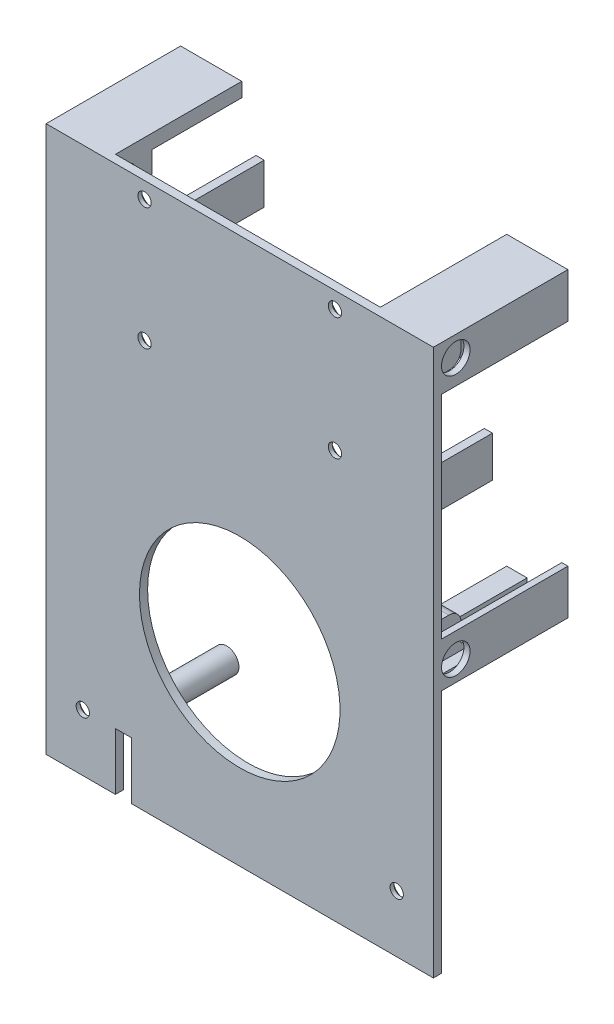
from build123d import *

# Parameters (mm, degrees)
SKETCH1_W                                 = 95
SKETCH1_H                                 = 134
BOSS_EXTRUDE1_DEPTH                       = 2
CSK_FOR_4_FLAT_HEAD_MACHINE_SCREW_2_COUNT = 2
CSK_FOR_4_FLAT_HEAD_MACHINE_SCREW_2_PITCH = 46.7
CSK_FOR_4_FLAT_HEAD_MACHINE_SCREW_3_COUNT = 2
CSK_FOR_4_FLAT_HEAD_MACHINE_SCREW_3_PITCH = 55.505765466
CSK_FOR_4_FLAT_HEAD_MACHINE_SCREW_4_COUNT = 2
CSK_FOR_4_FLAT_HEAD_MACHINE_SCREW_4_PITCH = 30
CSK_FOR_4_FLAT_HEAD_MACHINE_SCREW_5_COUNT = 2
CSK_FOR_4_FLAT_HEAD_MACHINE_SCREW_5_PITCH = 116.985137945
CSK_FOR_4_FLAT_HEAD_MACHINE_SCREW_6_COUNT = 2
CSK_FOR_4_FLAT_HEAD_MACHINE_SCREW_6_PITCH = 131.458824352
SKETCH13_R                                = 24.6
CUT_EXTRUDE2_DEPTH                        = 165.271117364
SKETCH14_R                                = 3
BOSS_EXTRUDE4_DEPTH                       = 19.3
SKETCH15_R                                = 1.15
CUT_EXTRUDE3_DEPTH                        = 15
SKETCH16_W                                = 4
SKETCH16_H                                = 14
CUT_EXTRUDE4_DEPTH                        = 166.388905311
SKETCH17_W                                = 15
SKETCH17_H                                = 11
BOSS_EXTRUDE5_DEPTH                       = 31
SKETCH18_W                                = 2.7
SKETCH18_H                                = 70
CUT_EXTRUDE5_DEPTH                        = 31
SKETCH19_W                                = 14.3
SKETCH19_H                                = 67
CUT_EXTRUDE6_DEPTH                        = 22
FILLET5_R                                 = 3
FILLET6_R                                 = 3
FILLET7_R                                 = 3
FILLET8_R                                 = 3
SKETCH20_W                                = 2
SKETCH20_H                                = 10
BOSS_EXTRUDE6_DEPTH                       = 31
CUT_EXTRUDE7_DEPTH                        = 165.807888161
CUT_EXTRUDE7_DEPTH_BACK                   = 165.807888161
SKETCH22_R                                = 1.15
SKETCH23_R                                = 3.5
CUT_EXTRUDE8_DEPTH                        = 1.5
CUT_EXTRUDE9_START                        = -1.5
SKETCH24_R                                = 3.5
CUT_EXTRUDE9_DEPTH                        = 1.5
SKETCH25_W                                = 3
SKETCH25_H                                = 3.5
CUT_EXTRUDE10_DEPTH                       = 17


with BuildPart() as part:
    # Sketch1 → Boss-Extrude1 (new body)
    with BuildSketch(Plane.XY):
        with Locations((47.5, 67)):
            Rectangle(SKETCH1_W, SKETCH1_H)
    extrude(amount=BOSS_EXTRUDE1_DEPTH)

    # Sketch8 → CSK for #4 Flat Head Machine Screw (100)2 (revolve, cut)
    with BuildSketch(Plane(origin=(70.85, 130, 0), x_dir=(0, 1, 0), z_dir=(1, 0, 0))):
        Polygon((0, 0), (0, 2), (1.63195, 2), (1.63195, 1.028358553), (2.8575, 0), align=None)
    csk_for_4_flat_head_machine_screw_100 = revolve(axis=Axis((70.85, 130, -6.35), (0, 0, 1)), mode=Mode.SUBTRACT)

    # CSK for _4 Flat Head Machine Screw _ 2: CSK for #4 Flat Head Machine Screw (100)2 ×2
    with Locations(*[(-i * CSK_FOR_4_FLAT_HEAD_MACHINE_SCREW_2_PITCH, 0, 0) for i in range(1, CSK_FOR_4_FLAT_HEAD_MACHINE_SCREW_2_COUNT)]):
        add(csk_for_4_flat_head_machine_screw_100, mode=Mode.SUBTRACT)

    # CSK for _4 Flat Head Machine Screw _ 3: CSK for #4 Flat Head Machine Screw (100)2 ×2
    with Locations(*[Vector(-0.8413540396691381, -0.540484393791738, 0) * (i * CSK_FOR_4_FLAT_HEAD_MACHINE_SCREW_3_PITCH) for i in range(1, CSK_FOR_4_FLAT_HEAD_MACHINE_SCREW_3_COUNT)]):
        add(csk_for_4_flat_head_machine_screw_100, mode=Mode.SUBTRACT)

    # CSK for _4 Flat Head Machine Screw _ 4: CSK for #4 Flat Head Machine Screw (100)2 ×2
    with Locations(*[(0, -i * CSK_FOR_4_FLAT_HEAD_MACHINE_SCREW_4_PITCH, 0) for i in range(1, CSK_FOR_4_FLAT_HEAD_MACHINE_SCREW_4_COUNT)]):
        add(csk_for_4_flat_head_machine_screw_100, mode=Mode.SUBTRACT)

    # CSK for _4 Flat Head Machine Screw _ 5: CSK for #4 Flat Head Machine Screw (100)2 ×2
    with Locations(*[Vector(0.12950362982970207, -0.991578947870986, 0) * (i * CSK_FOR_4_FLAT_HEAD_MACHINE_SCREW_5_PITCH) for i in range(1, CSK_FOR_4_FLAT_HEAD_MACHINE_SCREW_5_COUNT)]):
        add(csk_for_4_flat_head_machine_screw_100, mode=Mode.SUBTRACT)

    # CSK for _4 Flat Head Machine Screw _ 6: CSK for #4 Flat Head Machine Screw (100)2 ×2
    with Locations(*[Vector(-0.47048952632046626, -0.8824055788710445, 0) * (i * CSK_FOR_4_FLAT_HEAD_MACHINE_SCREW_6_PITCH) for i in range(1, CSK_FOR_4_FLAT_HEAD_MACHINE_SCREW_6_COUNT)]):
        add(csk_for_4_flat_head_machine_screw_100, mode=Mode.SUBTRACT)

    # Sketch13 → Cut-Extrude2 (cut, through all)
    with BuildSketch(Plane(origin=(0, 0, 0), x_dir=(-1, 0, 0), z_dir=(0, 0, -1))):
        with Locations((-47.5, 45.5)):
            Circle(SKETCH13_R)
    extrude(amount=-CUT_EXTRUDE2_DEPTH, mode=Mode.SUBTRACT)

    # Sketch14 → Boss-Extrude4 (add)
    with BuildSketch(Plane(origin=(0, 0, 0), x_dir=(-1, 0, 0), z_dir=(0, 0, -1))):
        with Locations((-72, 70.1)):
            Circle(SKETCH14_R)
        with Locations((-23, 70.1)):
            Circle(SKETCH14_R)
        with Locations((-72, 20.9)):
            Circle(SKETCH14_R)
        with Locations((-23, 20.9)):
            Circle(SKETCH14_R)
    extrude(amount=BOSS_EXTRUDE4_DEPTH)

    # Sketch15 → Cut-Extrude3 (cut)
    with BuildSketch(Plane(origin=(0, 0, -19.3), x_dir=(-1, 0, 0), z_dir=(0, 0, -1))):
        with Locations((-72, 70.1)):
            Circle(SKETCH15_R)
        with Locations((-23, 70.1)):
            Circle(SKETCH15_R)
        with Locations((-23, 20.9)):
            Circle(SKETCH15_R)
        with Locations((-72, 20.9)):
            Circle(SKETCH15_R)
    extrude(amount=-CUT_EXTRUDE3_DEPTH, mode=Mode.SUBTRACT)

    # Sketch16 → Cut-Extrude4 (cut, through all)
    with BuildSketch(Plane(origin=(0, 0, 0), x_dir=(-1, 0, 0), z_dir=(0, 0, -1))):
        with Locations((-19, 7)):
            Rectangle(SKETCH16_W, SKETCH16_H)
    extrude(amount=-CUT_EXTRUDE4_DEPTH, mode=Mode.SUBTRACT)

    # Sketch17 → Boss-Extrude5 (add)
    with BuildSketch(Plane(origin=(0, 0, 0), x_dir=(-1, 0, 0), z_dir=(0, 0, -1))):
        with Locations((-87.5, 128.5)):
            Rectangle(SKETCH17_W, SKETCH17_H)
        with Locations((-87.5, 65.5)):
            Rectangle(SKETCH17_W, SKETCH17_H)
        with Locations((-7.5, 65.5)):
            Rectangle(SKETCH17_W, SKETCH17_H)
        with Locations((-7.5, 128.5)):
            Rectangle(SKETCH17_W, SKETCH17_H)
    extrude(amount=BOSS_EXTRUDE5_DEPTH)

    # Sketch18 → Cut-Extrude5 (cut)
    with BuildSketch(Plane(origin=(0, 0, -31), x_dir=(-1, 0, 0), z_dir=(0, 0, -1))):
        with Locations((-92.15, 97)):
            Rectangle(SKETCH18_W, SKETCH18_H)
        with Locations((-2.85, 97)):
            Rectangle(SKETCH18_W, SKETCH18_H)
    extrude(amount=-CUT_EXTRUDE5_DEPTH, mode=Mode.SUBTRACT)

    # Sketch19 → Cut-Extrude6 (cut)
    with BuildSketch(Plane(origin=(0, 0, -31), x_dir=(-1, 0, 0), z_dir=(0, 0, -1))):
        with Locations((-83.65, 97)):
            Rectangle(SKETCH19_W, SKETCH19_H)
        with Locations((-11.35, 97)):
            Rectangle(SKETCH19_W, SKETCH19_H)
    extrude(amount=-CUT_EXTRUDE6_DEPTH, mode=Mode.SUBTRACT)

    # Fillet5
    fillet5_edges = [part.edges().sort_by_distance(p)[0] for p in [
        (85.4, 123, -9),
    ]]
    fillet(fillet5_edges, radius=FILLET5_R)

    # Fillet6
    fillet6_edges = [part.edges().sort_by_distance(p)[0] for p in [
        (9.6, 123, -9),
    ]]
    fillet(fillet6_edges, radius=FILLET6_R)

    # Fillet7
    fillet7_edges = [part.edges().sort_by_distance(p)[0] for p in [
        (9.6, 71, -9),
    ]]
    fillet(fillet7_edges, radius=FILLET7_R)

    # Fillet8
    fillet8_edges = [part.edges().sort_by_distance(p)[0] for p in [
        (85.4, 71, -9),
    ]]
    fillet(fillet8_edges, radius=FILLET8_R)

    # Sketch20 → Boss-Extrude6 (add)
    with BuildSketch(Plane(origin=(0, 0, 0), x_dir=(-1, 0, 0), z_dir=(0, 0, -1))):
        with Locations((-75.5, 115)):
            Rectangle(SKETCH20_W, SKETCH20_H)
        with Locations((-75.5, 85)):
            Rectangle(SKETCH20_W, SKETCH20_H)
        with Locations((-19.5, 85)):
            Rectangle(SKETCH20_W, SKETCH20_H)
        with Locations((-19.5, 115)):
            Rectangle(SKETCH20_W, SKETCH20_H)
    extrude(amount=BOSS_EXTRUDE6_DEPTH)

    # Sketch22 → Cut-Extrude7 (cut, two sides: drawn at the far end of the back side and taken through both)
    with BuildSketch(Plane(origin=(90.8, 0, 0), x_dir=(0, 0, -1), z_dir=(1, 0, 0)).offset(-CUT_EXTRUDE7_DEPTH_BACK)):
        with Locations((3.5, 129)):
            Circle(SKETCH22_R)
        with Locations(Location((3.5, 65, 0), (0, 0, 90))):
            Circle(SKETCH22_R)
    extrude(amount=CUT_EXTRUDE7_DEPTH + CUT_EXTRUDE7_DEPTH_BACK, mode=Mode.SUBTRACT)

    # Sketch23 → Cut-Extrude8 (cut)
    with BuildSketch(Plane(origin=(95, 0, 0), x_dir=(0, 0, -1), z_dir=(1, 0, 0))):
        with Locations((3.5, 129)):
            Circle(SKETCH23_R)
        with Locations((3.5, 65)):
            Circle(SKETCH23_R)
    extrude(amount=-CUT_EXTRUDE8_DEPTH, mode=Mode.SUBTRACT)

    # Sketch24 → Cut-Extrude9 (cut)
    with BuildSketch(Plane.ZY.offset(CUT_EXTRUDE9_START)):
        with Locations(Location((-3.5, 129, 0), (0, 0, 180))):
            Circle(SKETCH24_R)
        with Locations(Location((-3.5, 65, 0), (0, 0, 180))):
            Circle(SKETCH24_R)
    extrude(amount=CUT_EXTRUDE9_DEPTH, mode=Mode.SUBTRACT)

    # Sketch25 → Cut-Extrude10 (cut)
    with BuildSketch(Plane(origin=(0, 0, -31), x_dir=(-1, 0, 0), z_dir=(0, 0, -1))):
        with Locations((-8.5, 61.75)):
            Rectangle(SKETCH25_W, SKETCH25_H)
        with Locations((-86.5, 61.75)):
            Rectangle(SKETCH25_W, SKETCH25_H)
    extrude(amount=-CUT_EXTRUDE10_DEPTH, mode=Mode.SUBTRACT)


solid = part.part
